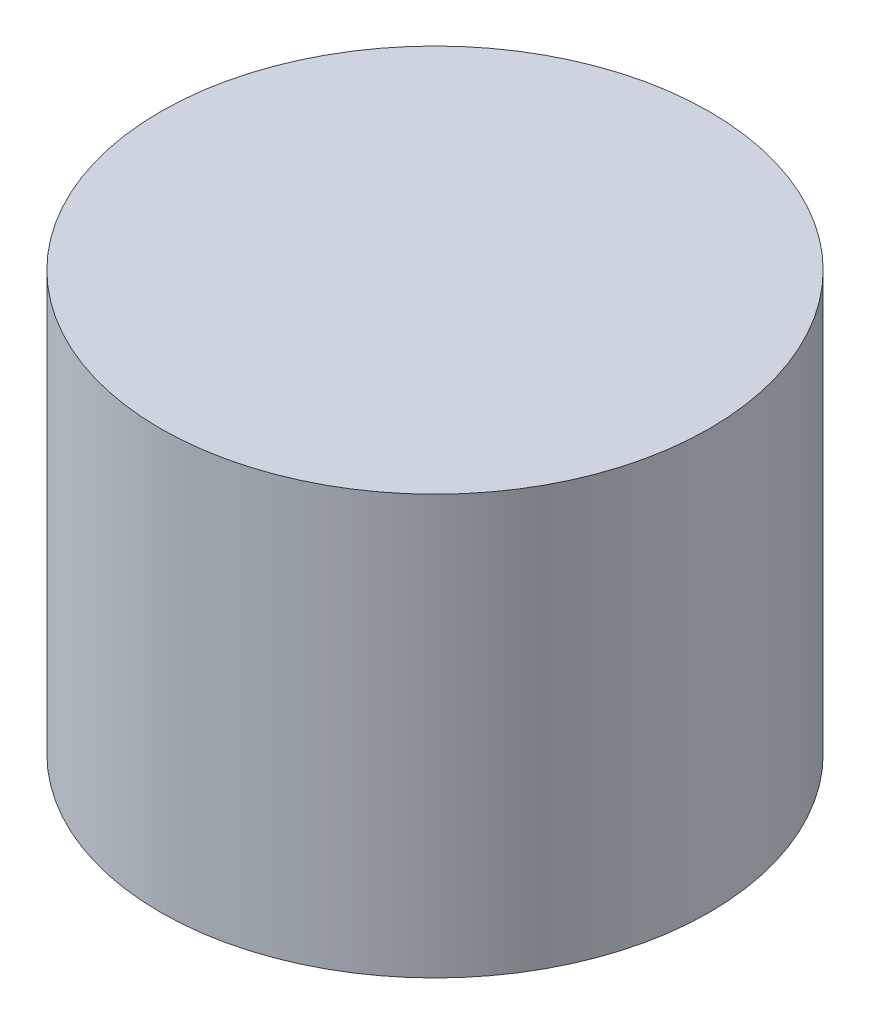
from build123d import *

# Parameters (mm, degrees)
SKETCH1_R           = 19
BOSS_EXTRUDE1_DEPTH = 29


with BuildPart() as part:
    # Sketch1 → Boss-Extrude1 (new body)
    with BuildSketch(Plane(origin=(0, 0, 0), x_dir=(1, 0, 0), z_dir=(0, 1, 0))):
        with Locations(Location((0, 0, 0), (0, 0, 270))):
            Circle(SKETCH1_R)
    extrude(amount=BOSS_EXTRUDE1_DEPTH)


solid = part.part
